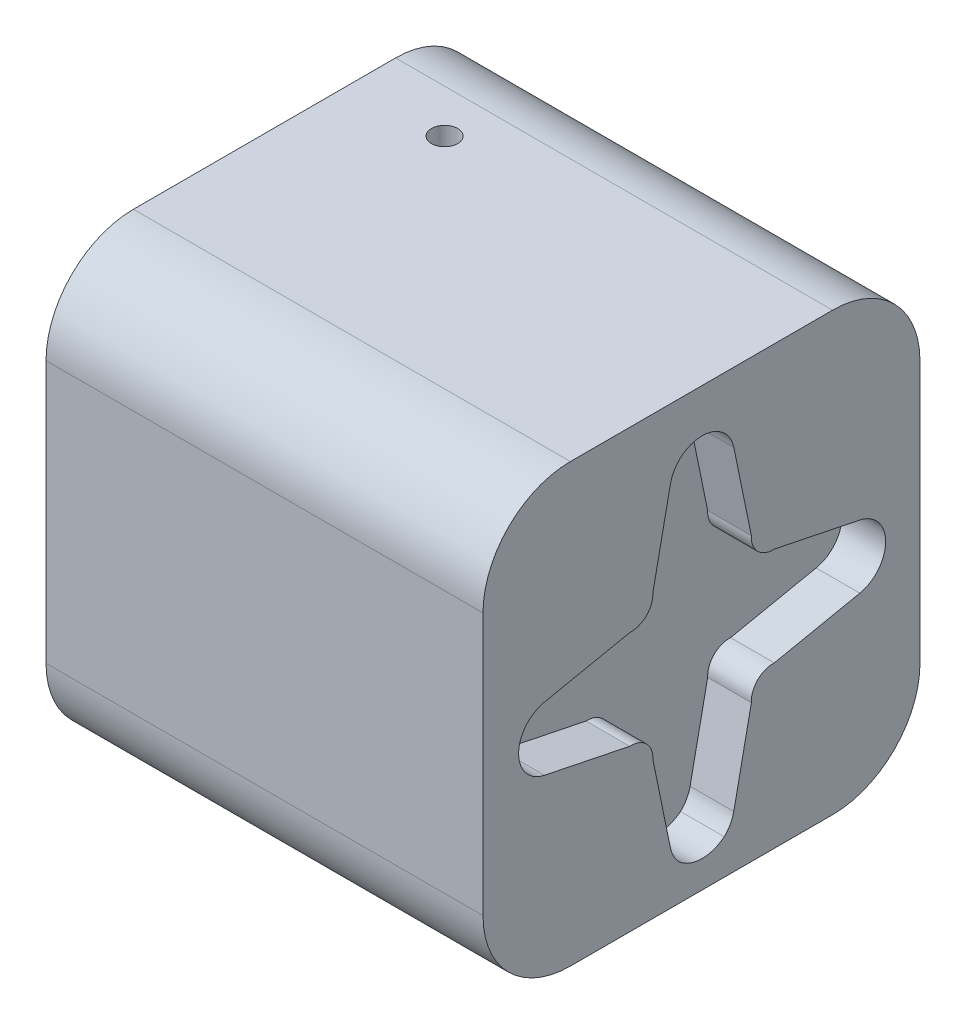
from build123d import *

# Parameters (mm, degrees)
ESQUISSE1_W             = 50
ESQUISSE1_H             = 50
BOSS_EXTRU_1_DEPTH      = 50
ESQUISSE2_R             = 6
ENL_V_MAT_EXTRU_1_DEPTH = 40
CONG_1_R                = 10
ESQUISSE3_R             = 1.5
ENL_V_MAT_EXTRU_2_DEPTH = 15
ENL_V_MAT_EXTRU_3_DEPTH = 5


with BuildPart() as part:
    # Esquisse1 → Boss.-Extru.1 (new body)
    with BuildSketch(Plane.XY):
        with Locations((25, 25)):
            Rectangle(ESQUISSE1_W, ESQUISSE1_H)
    extrude(amount=BOSS_EXTRU_1_DEPTH)

    # Esquisse2 → Enlèv. mat.-Extru.1 (cut)
    with BuildSketch(Plane.ZY):
        with Locations((24.976890997, 24.856256207)):
            Circle(ESQUISSE2_R)
    extrude(amount=-ENL_V_MAT_EXTRU_1_DEPTH, mode=Mode.SUBTRACT)

    # Congé1
    cong_1_edges = [part.edges().sort_by_distance(p)[0] for p in [
        (25, 50, 50),
        (25, 50, 0),
        (25, 0, 0),
        (25, 0, 50),
    ]]
    fillet(cong_1_edges, radius=CONG_1_R)

    # Esquisse3 → Enlèv. mat.-Extru.2 (cut)
    with BuildSketch(Plane(origin=(0, 50, 0), x_dir=(1, 0, 0), z_dir=(0, 1, 0))):
        with Locations(Location((10.546738136, -14.940962314, 0), (0, 0, 270))):
            Circle(ESQUISSE3_R)
    extrude(amount=-ENL_V_MAT_EXTRU_2_DEPTH, mode=Mode.SUBTRACT)

    # Esquisse4 → Enlèv. mat.-Extru.3 (cut)
    with BuildSketch(Plane(origin=(50, 0, 0), x_dir=(0, 0, -1), z_dir=(1, 0, 0))):
        with BuildLine():
            Line((-19.291182269, 32.286465455), (-21.302414692, 42.065190949))
            ThreePointArc((-21.302414692, 42.065190949), (-24.926554612, 45.019798544), (-28.550694532, 42.065190949))
            Line((-28.550694532, 42.065190949), (-30.561926955, 32.286465455))
            ThreePointArc((-30.561926955, 32.286465455), (-31.290515643, 30.383759574), (-33.193221523, 29.655170887))
            Line((-33.193221523, 29.655170887), (-42.971947017, 27.643938464))
            ThreePointArc((-42.971947017, 27.643938464), (-45.926554612, 24.019798544), (-42.971947017, 20.395658623))
            Line((-42.971947017, 20.395658623), (-33.193221523, 18.384426201))
            ThreePointArc((-33.193221523, 18.384426201), (-31.290515643, 17.655837513), (-30.561926955, 15.753131632))
            Line((-30.561926955, 15.753131632), (-28.550694532, 5.974406139))
            ThreePointArc((-28.550694532, 5.974406139), (-28.155011664, 4.912296106), (-27.45637674, 4.019798544))
            ThreePointArc((-27.45637674, 4.019798544), (-24.926554612, 3.123395403), (-22.396732484, 4.019798544))
            ThreePointArc((-22.396732484, 4.019798544), (-21.69809756, 4.912296106), (-21.302414692, 5.974406139))
            Line((-21.302414692, 5.974406139), (-19.291182269, 15.753131632))
            ThreePointArc((-19.291182269, 15.753131632), (-18.562593581, 17.655837513), (-16.6598877, 18.384426201))
            Line((-16.6598877, 18.384426201), (-6.881162207, 20.395658623))
            ThreePointArc((-6.881162207, 20.395658623), (-3.926554612, 24.019798544), (-6.881162207, 27.643938464))
            Line((-6.881162207, 27.643938464), (-16.6598877, 29.655170887))
            ThreePointArc((-16.6598877, 29.655170887), (-18.562593581, 30.383759574), (-19.291182269, 32.286465455))
        make_face()
    extrude(amount=-ENL_V_MAT_EXTRU_3_DEPTH, mode=Mode.SUBTRACT)


solid = part.part
